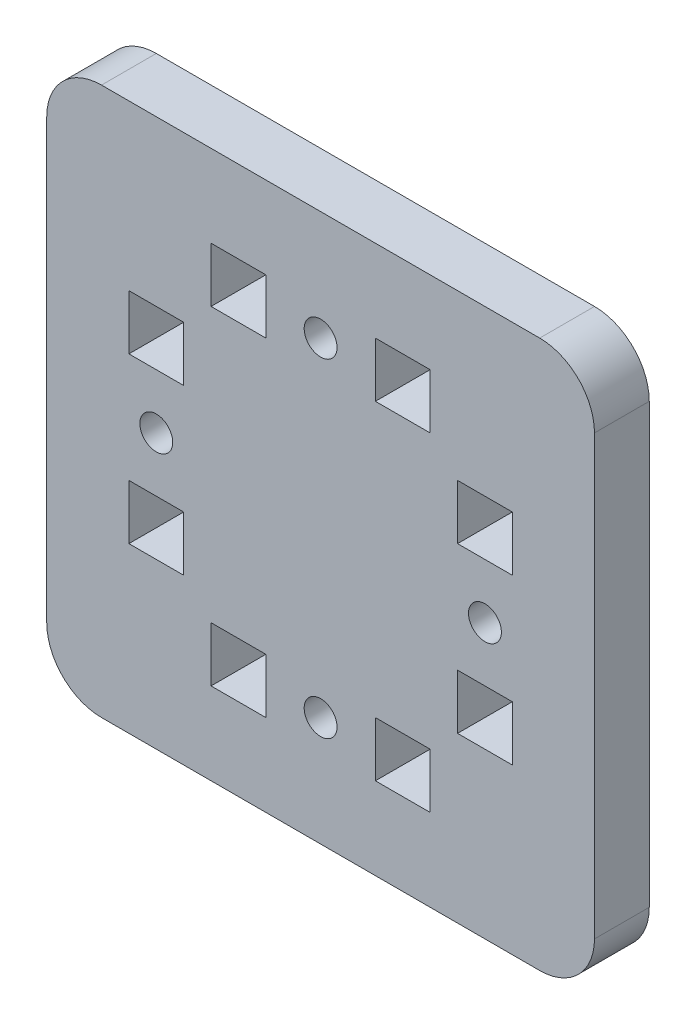
from build123d import *

# Parameters (mm, degrees)
SKETCH1_W           = 50
SKETCH1_H           = 50
SKETCH1_R           = 1.5
SKETCH1_W_2         = 5
SKETCH1_H_2         = 5
BOSS_EXTRUDE1_DEPTH = 5
FILLET1_R           = 5


with BuildPart() as part:
    # Sketch1 → Boss-Extrude1 (new body)
    with BuildSketch(Plane.XY):
        with Locations((25, 25)):
            Rectangle(SKETCH1_W, SKETCH1_H)
        with Locations((40, 25)):
            Circle(SKETCH1_R, mode=Mode.SUBTRACT)
        with Locations((10, 25)):
            Circle(SKETCH1_R, mode=Mode.SUBTRACT)
        with Locations((25, 40)):
            Circle(SKETCH1_R, mode=Mode.SUBTRACT)
        with Locations(Location((25, 10, 0), (0, 0, 90))):
            Circle(SKETCH1_R, mode=Mode.SUBTRACT)
        with Locations((40, 17.5)):
            Rectangle(SKETCH1_W_2, SKETCH1_H_2, mode=Mode.SUBTRACT)
        with Locations((40, 32.5)):
            Rectangle(SKETCH1_W_2, SKETCH1_H_2, mode=Mode.SUBTRACT)
        with Locations((10, 17.5)):
            Rectangle(SKETCH1_W_2, SKETCH1_H_2, mode=Mode.SUBTRACT)
        with Locations((10, 32.5)):
            Rectangle(SKETCH1_W_2, SKETCH1_H_2, mode=Mode.SUBTRACT)
        with Locations((32.5, 40)):
            Rectangle(SKETCH1_W_2, SKETCH1_H_2, mode=Mode.SUBTRACT)
        with Locations((17.5, 40)):
            Rectangle(SKETCH1_W_2, SKETCH1_H_2, mode=Mode.SUBTRACT)
        with Locations((32.5, 10)):
            Rectangle(SKETCH1_W_2, SKETCH1_H_2, mode=Mode.SUBTRACT)
        with Locations((17.5, 10)):
            Rectangle(SKETCH1_W_2, SKETCH1_H_2, mode=Mode.SUBTRACT)
    extrude(amount=BOSS_EXTRUDE1_DEPTH)

    # Fillet1
    fillet1_edges = [part.edges().sort_by_distance(p)[0] for p in [
        (0, 50, 2.5),
        (50, 50, 2.5),
        (50, 0, 2.5),
        (0, 0, 2.5),
    ]]
    fillet(fillet1_edges, radius=FILLET1_R)


solid = part.part
